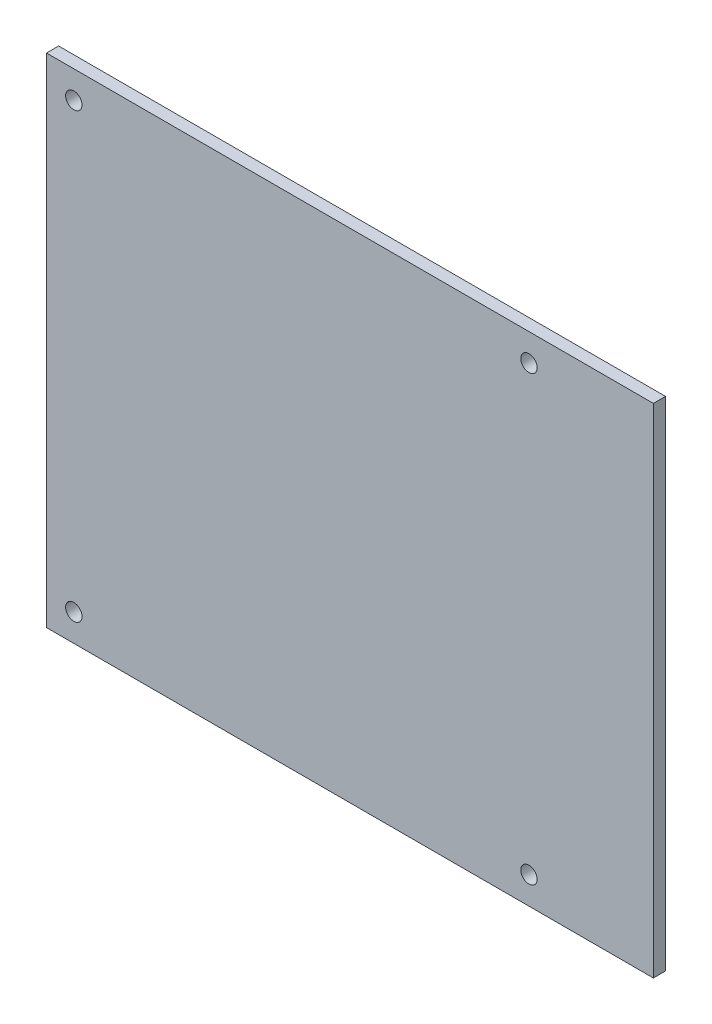
from build123d import *

# Parameters (mm, degrees)
ESQUISSE1_W        = 100
ESQUISSE1_H        = 82
ESQUISSE1_R        = 1.35
BOSS_EXTRU_1_DEPTH = 2


with BuildPart() as part:
    # Esquisse1 → Boss.-Extru.1 (new body)
    with BuildSketch(Plane.XY.offset(50.5)):
        with Locations((9.361165235, -54.8)):
            Rectangle(ESQUISSE1_W, ESQUISSE1_H)
        with Locations((-36.138834765, -91.3)):
            Circle(ESQUISSE1_R, mode=Mode.SUBTRACT)
        with Locations((-36.138834765, -18.3)):
            Circle(ESQUISSE1_R, mode=Mode.SUBTRACT)
        with Locations((38.861165235, -91.3)):
            Circle(ESQUISSE1_R, mode=Mode.SUBTRACT)
        with Locations((38.861165235, -18.3)):
            Circle(ESQUISSE1_R, mode=Mode.SUBTRACT)
    extrude(amount=BOSS_EXTRU_1_DEPTH)


solid = part.part
